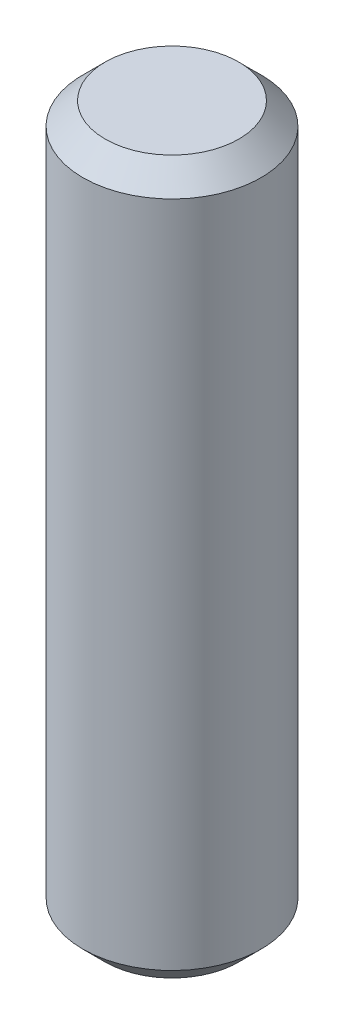
from build123d import *

# Parameters (mm, degrees)
SKETCH1_R           = 1.5875
BOSS_EXTRUDE1_DEPTH = 12.7
CHAMFER1_SIZE       = 0.396875


with BuildPart() as part:
    # Sketch1 → Boss-Extrude1 (new body)
    with BuildSketch(Plane(origin=(0, 0, 0), x_dir=(1, 0, 0), z_dir=(0, 1, 0))):
        with Locations(Location((0, 0, 0), (0, 0, 270))):
            Circle(SKETCH1_R)
    extrude(amount=BOSS_EXTRUDE1_DEPTH)

    # Chamfer1
    chamfer1_edges = [part.edges().sort_by_distance(p)[0] for p in [
        (0, 0, -1.5875),
        (0, 12.7, -1.5875),
    ]]
    chamfer(chamfer1_edges, length=CHAMFER1_SIZE)


solid = part.part
